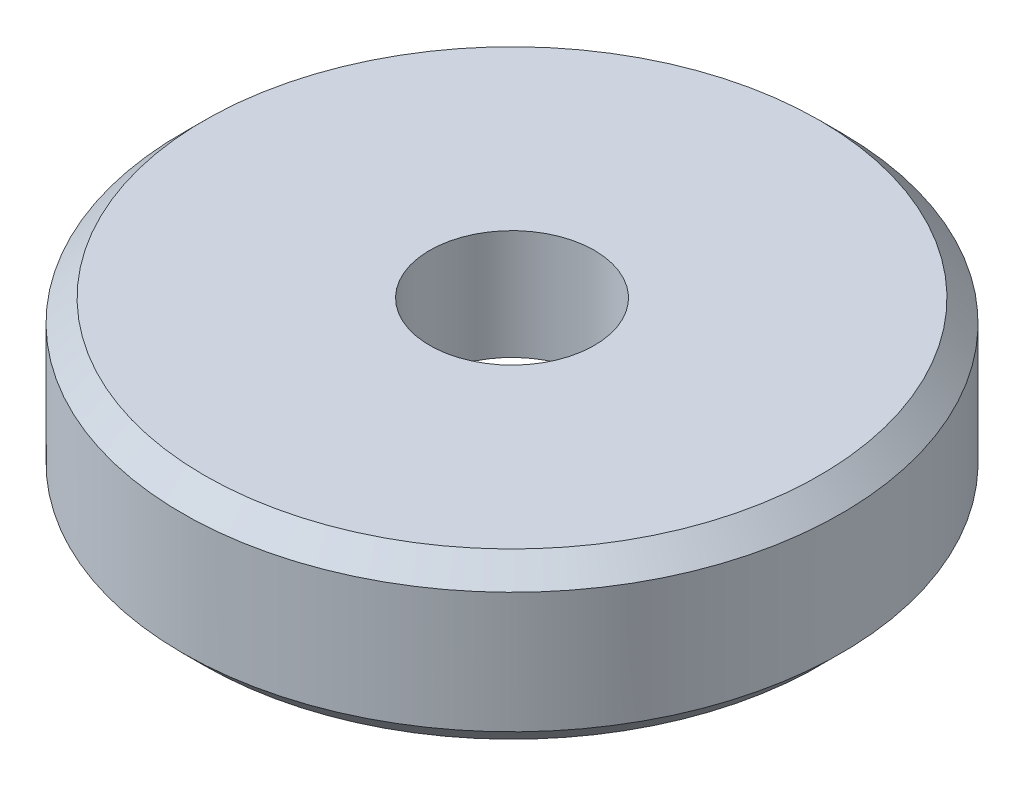
from build123d import *

# Parameters (mm, degrees)
SKETCH1_R           = 38.1
SKETCH1_R_2         = 9.525
BOSS_EXTRUDE1_DEPTH = 19.05
CHAMFER1_SIZE       = 2.54
SKETCH3_R           = 25.4
CUT_EXTRUDE2_DEPTH  = 6.35


with BuildPart() as part:
    # Sketch1 → Boss-Extrude1 (new body)
    with BuildSketch(Plane(origin=(0, 0, 0), x_dir=(1, 0, 0), z_dir=(0, 1, 0))):
        with Locations(Location((0, 0, 0), (0, 0, 90))):
            Circle(SKETCH1_R)
        with Locations(Location((0, 0, 0), (0, 0, 90))):
            Circle(SKETCH1_R_2, mode=Mode.SUBTRACT)
    extrude(amount=BOSS_EXTRUDE1_DEPTH)

    # Chamfer1
    chamfer1_edges = [part.edges().sort_by_distance(p)[0] for p in [
        (0, 0, 38.1),
        (0, 19.05, 38.1),
    ]]
    chamfer(chamfer1_edges, length=CHAMFER1_SIZE)

    # Sketch3 → Cut-Extrude2 (cut)
    with BuildSketch(Plane(origin=(0, 0, 0), x_dir=(-1, 0, 0), z_dir=(0, -1, 0))):
        with Locations(Location((0, 0, 0), (0, 0, 90))):
            Circle(SKETCH3_R)
    extrude(amount=-CUT_EXTRUDE2_DEPTH, mode=Mode.SUBTRACT)


solid = part.part
